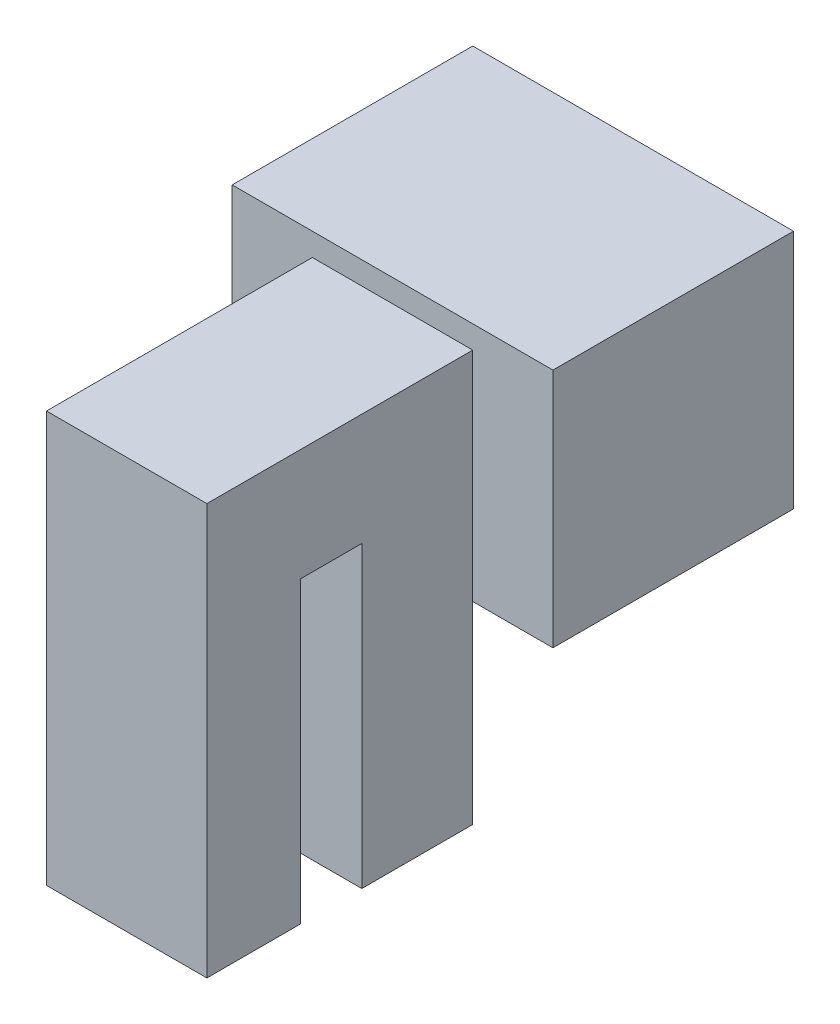
from build123d import *

# Parameters (mm, degrees)
ESQUISSE1_W        = 40
ESQUISSE1_H        = 30
BOSS_EXTRU_1_DEPTH = 30
BOSS_EXTRU_2_START = -10
BOSS_EXTRU_2_DEPTH = 20


with BuildPart() as part:
    # Esquisse1 → Boss.-Extru.1 (new body)
    with BuildSketch(Plane.XY):
        with Locations((-20, 15)):
            Rectangle(ESQUISSE1_W, ESQUISSE1_H)
    extrude(amount=BOSS_EXTRU_1_DEPTH)

    # Esquisse2 → Boss.-Extru.2 (add)
    with BuildSketch(Plane.ZY.offset(40).offset(BOSS_EXTRU_2_START)):
        Polygon((30, 27.158170339), (63.156193336, 27.158170339), (63.156193336, -24.079833233), (51.504613428, -24.079833233), (51.504613428, 13.190748461), (43.833386904, 13.190748461), (43.833386904, -24.079833233), (30, -24.079833233), align=None)
    extrude(amount=-BOSS_EXTRU_2_DEPTH)


solid = part.part
